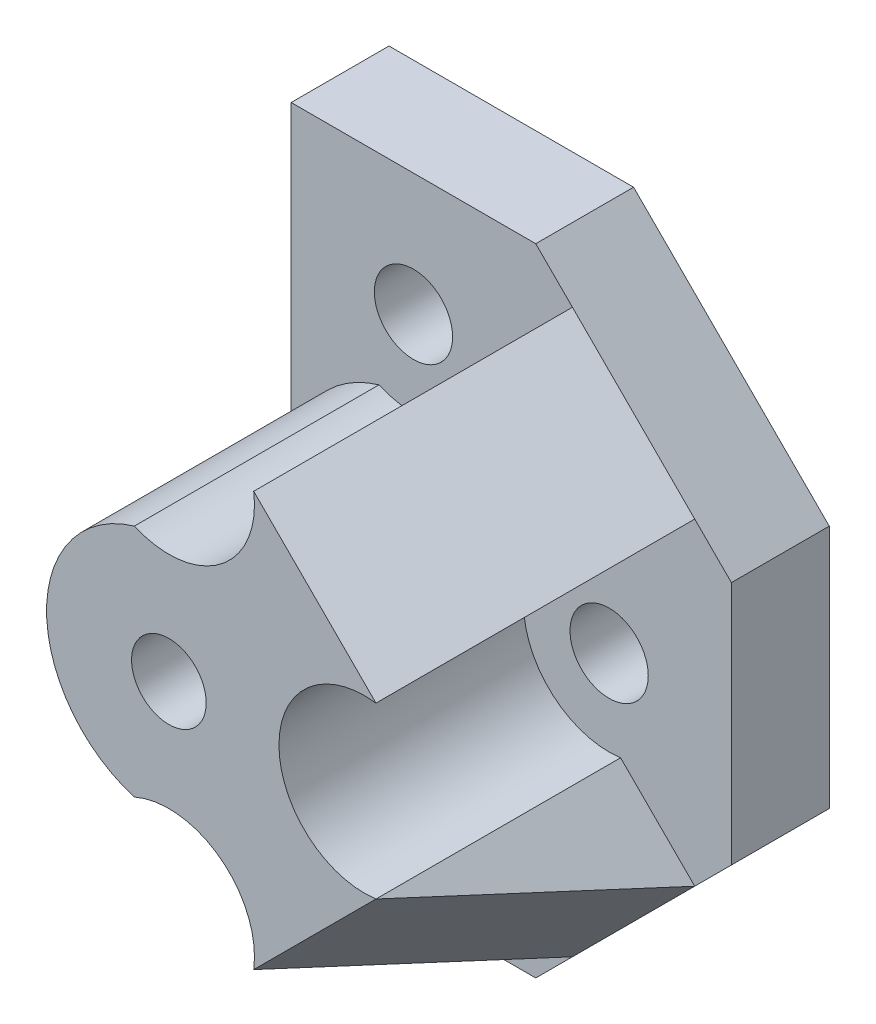
from build123d import *

# Parameters (mm, degrees)
SKETCH_1_R          = 1.6
SKETCH_1_R_2        = 3.2
EXTRUDE_1_DEPTH     = 4
SKETCH_2_R          = 1.525
EXTRUDE_2_DEPTH     = 10
CUT_EXTRUDE_1_DEPTH = 10
CUT_EXTRUDE_2_DEPTH = 10


with BuildPart() as part:
    # 草图1 → 凸台-拉伸1 (new body)
    with BuildSketch(Plane.XY):
        Polygon((0, 0), (0, 26), (10, 26), (18, 18), (18, 8), (10, 0), align=None)
        with Locations((5, 21)):
            Circle(SKETCH_1_R, mode=Mode.SUBTRACT)
        with Locations((5, 13)):
            Circle(SKETCH_1_R_2, mode=Mode.SUBTRACT)
        with Locations((5, 5)):
            Circle(SKETCH_1_R, mode=Mode.SUBTRACT)
        with Locations((13, 13)):
            Circle(SKETCH_1_R, mode=Mode.SUBTRACT)
    extrude(amount=EXTRUDE_1_DEPTH)

    # 草图2 → 凸台-拉伸2 (add)
    with BuildSketch(Plane.XY.offset(4)):
        with BuildLine():
            Line((13.468501969, 16.468501969), (16.5, 19.5))
            Line((16.5, 19.5), (11.5, 24.5))
            Line((11.5, 24.5), (8.468501969, 21.468501969))
            ThreePointArc((8.468501969, 21.468501969), (7.104490226, 18.203373302), (3.589329863, 17.796875))
            ThreePointArc((3.589329863, 17.796875), (0, 13), (3.589329863, 8.203125))
            ThreePointArc((3.589329863, 8.203125), (7.104490226, 7.796626698), (8.468501969, 4.531498031))
            Line((8.468501969, 4.531498031), (11.5, 1.5))
            Line((11.5, 1.5), (16.5, 6.5))
            Line((16.5, 6.5), (13.468501969, 9.531498031))
            ThreePointArc((13.468501969, 9.531498031), (9.5, 13), (13.468501969, 16.468501969))
        make_face()
        with Locations((5, 13)):
            Circle(SKETCH_2_R, mode=Mode.SUBTRACT)
    extrude(amount=EXTRUDE_2_DEPTH)

    # 草图3 → 切除-拉伸1 (cut)
    with BuildSketch(Plane(origin=(-1.5, 1.5, 0), x_dir=(0, 0, -1), z_dir=(0.7071067811865477, -0.7071067811865475, 0))):
        Polygon((-4, 25.455844123), (-14, 25.455844123), (-14, 21.168658492), align=None)
    extrude(amount=-CUT_EXTRUDE_1_DEPTH, mode=Mode.SUBTRACT)

    # 草图4 → 切除-拉伸2 (cut)
    with BuildSketch(Plane(origin=(11.5, 11.5, 0), x_dir=(0, 0, -1), z_dir=(0.7071067811865474, 0.7071067811865477, 0))):
        Polygon((-4, -7.071067812), (-14, -2.783882181), (-14, -7.071067812), align=None)
    extrude(amount=-CUT_EXTRUDE_2_DEPTH, mode=Mode.SUBTRACT)


solid = part.part
